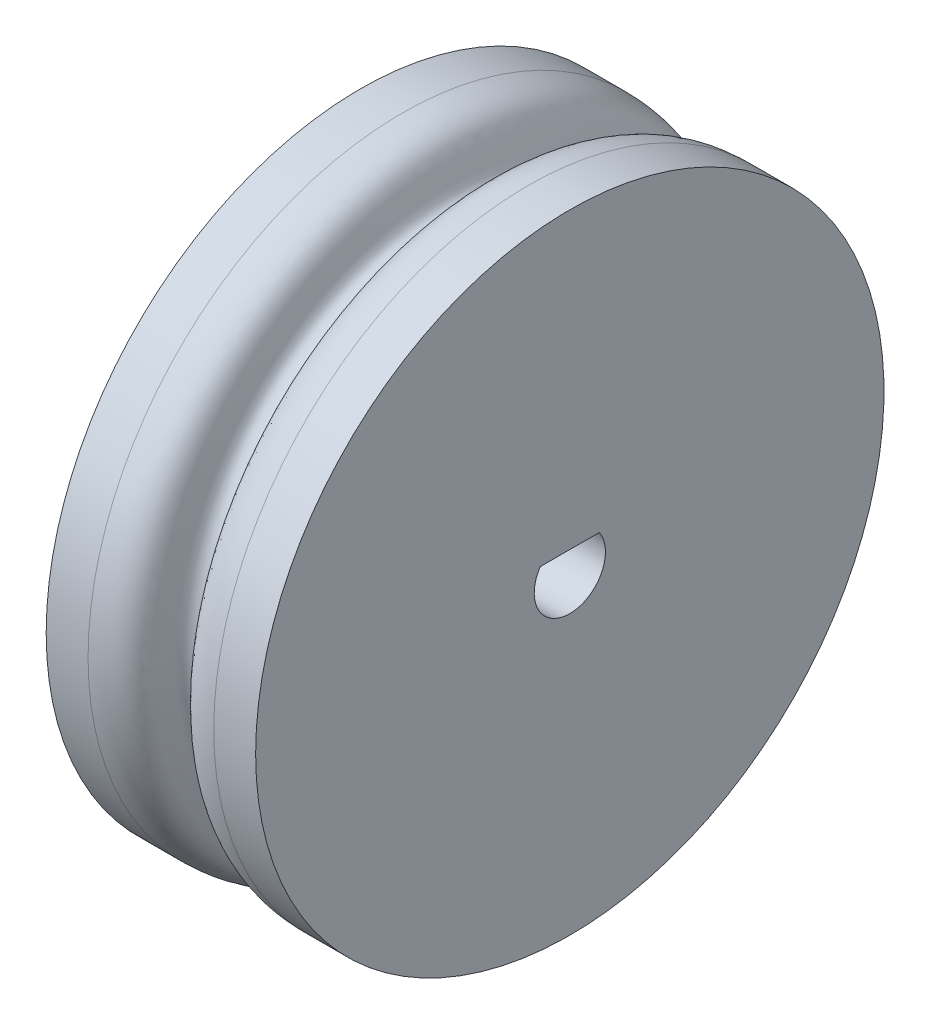
from build123d import *

# Parameters (mm, degrees)
CUT_EXTRUDE1_DEPTH = 47.904157726


with BuildPart() as part:
    # Sketch1 → Revolve1 (revolve)
    with BuildSketch(Plane.XY, mode=Mode.PRIVATE) as revolve1_sk:
        with BuildLine():
            Line((0, 25), (0, 0))
            Line((0, 0), (10, 0))
            Line((10, 0), (10, 30))
            Line((10, 30), (6, 30))
            add(Edge.make_bspline(
                [(0, 25), (2.935087376, 25), (0.191816931, 30), (6, 30)],
                knots=[0, 0, 0, 0, 1, 1, 1, 1], degree=3))
        make_face()
    revolve1 = revolve(revolve1_sk.sketch.rotate(Axis((0, 0, 0), (1, 0, 0)), 90), axis=Axis((0, 0, 0), (1, 0, 0)))

    # Mirror1: Revolve1 across plane
    add(revolve1.mirror(Plane(origin=(0, 25, 0), x_dir=(0, 0, 1), z_dir=(1, 0, 0))))

    # Sketch2 → Cut-Extrude1 (cut, through all)
    with BuildSketch(Plane(origin=(10, 0, 0), x_dir=(0, 0, -1), z_dir=(1, 0, 0))):
        with BuildLine():
            Line((-2.819574436, 1.9), (2.819574436, 1.9))
            ThreePointArc((2.819574436, 1.9), (0, -3.4), (-2.819574436, 1.9))
        make_face()
    extrude(amount=-CUT_EXTRUDE1_DEPTH, mode=Mode.SUBTRACT)


solid = part.part
